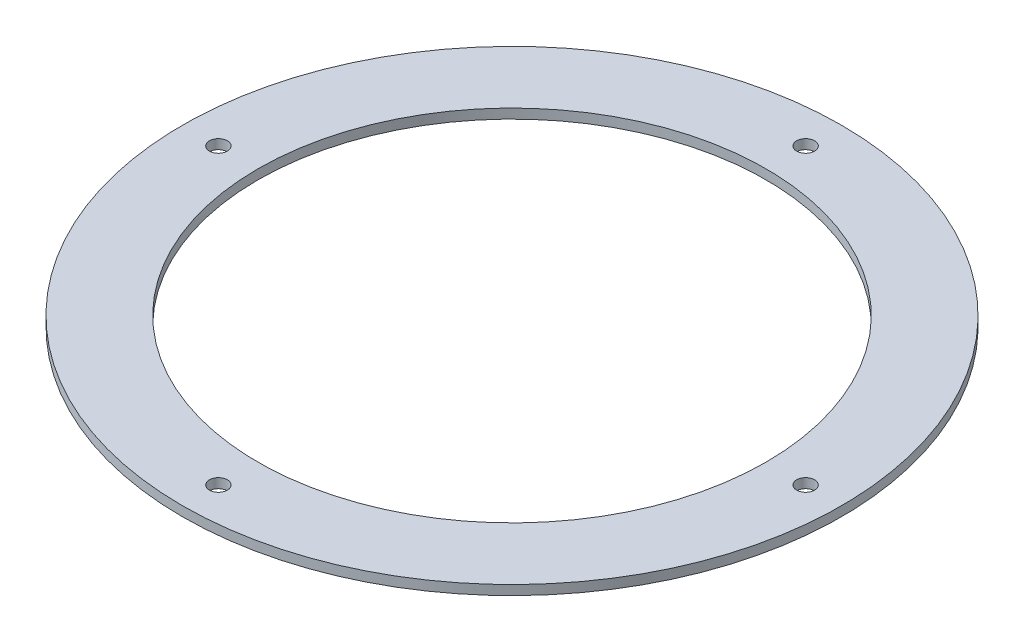
from build123d import *

# Parameters (mm, degrees)
SKETCH_1_R          = 55
SKETCH_1_R_2        = 42.4
EXTRUDE_1_DEPTH     = 1.6
SKETCH_2_R          = 1.5
CUT_EXTRUDE_1_DEPTH = 1.6


with BuildPart() as part:
    # 草图1 → 拉伸-薄壁1 (new body)
    with BuildSketch(Plane(origin=(0, 0, 0), x_dir=(1, 0, 0), z_dir=(0, 1, 0))):
        Circle(SKETCH_1_R)
        Circle(SKETCH_1_R_2, mode=Mode.SUBTRACT)
    extrude(amount=EXTRUDE_1_DEPTH)

    # 草图2 → 切除-拉伸1 (cut)
    with BuildSketch(Plane(origin=(0, 1.6, 0), x_dir=(1, 0, 0), z_dir=(0, 1, 0))):
        with Locations(Location((-49, 0, 0), (0, 0, 270))):
            Circle(SKETCH_2_R)
        with Locations(Location((0, 49, 0), (0, 0, 270))):
            Circle(SKETCH_2_R)
        with Locations(Location((49, 0, 0), (0, 0, 270))):
            Circle(SKETCH_2_R)
        with Locations(Location((0, -49, 0), (0, 0, 270))):
            Circle(SKETCH_2_R)
    extrude(amount=-CUT_EXTRUDE_1_DEPTH, mode=Mode.SUBTRACT)


solid = part.part
